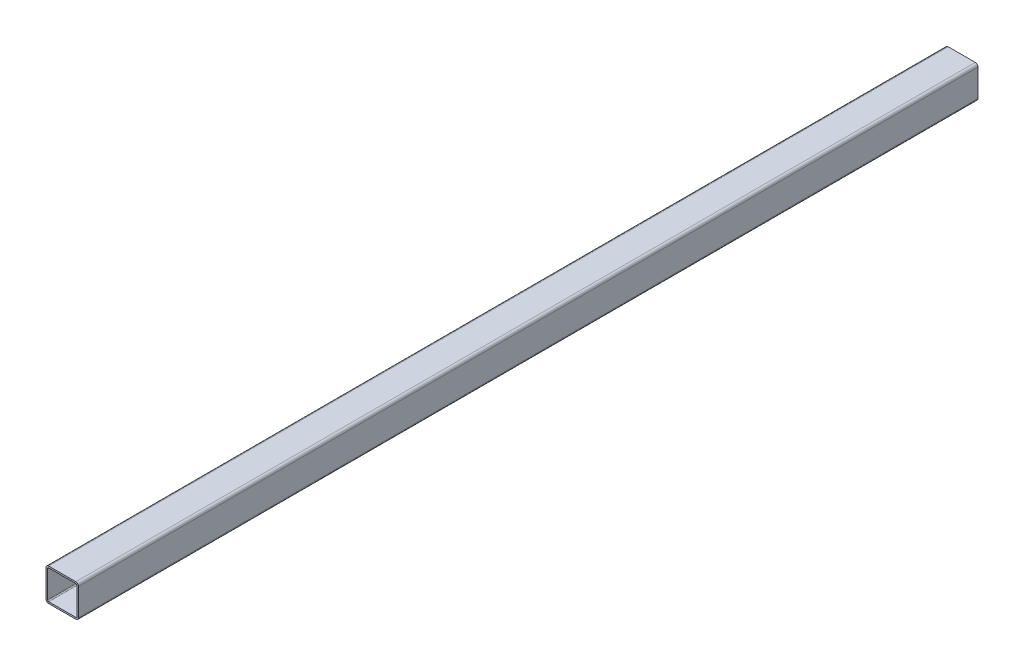
from build123d import *

# Parameters (mm, degrees)
EXTRUDE_1_DEPTH = 830
SHELL_1_T       = -3


with BuildPart() as part:
    # Эскиз1 → Бобышка-Вытянуть1 (new, symmetric)
    with BuildSketch(Plane.XY):
        with BuildLine():
            Line((-25, -30), (25, -30))
            ThreePointArc((25, -30), (28.535533906, -28.535533906), (30, -25))
            Line((30, -25), (30, 25))
            ThreePointArc((30, 25), (28.535533906, 28.535533906), (25, 30))
            Line((25, 30), (-25, 30))
            ThreePointArc((-25, 30), (-28.535533906, 28.535533906), (-30, 25))
            Line((-30, 25), (-30, -25))
            ThreePointArc((-30, -25), (-28.535533906, -28.535533906), (-25, -30))
        make_face()
    extrude(amount=EXTRUDE_1_DEPTH, both=True)

    # Оболочка1
    shell_1_openings = [part.faces().sort_by_distance(p)[0] for p in [
        (0, 0, 830),
        (0, 0, -830),
    ]]
    offset(amount=SHELL_1_T, openings=shell_1_openings, kind=Kind.INTERSECTION)


solid = part.part
